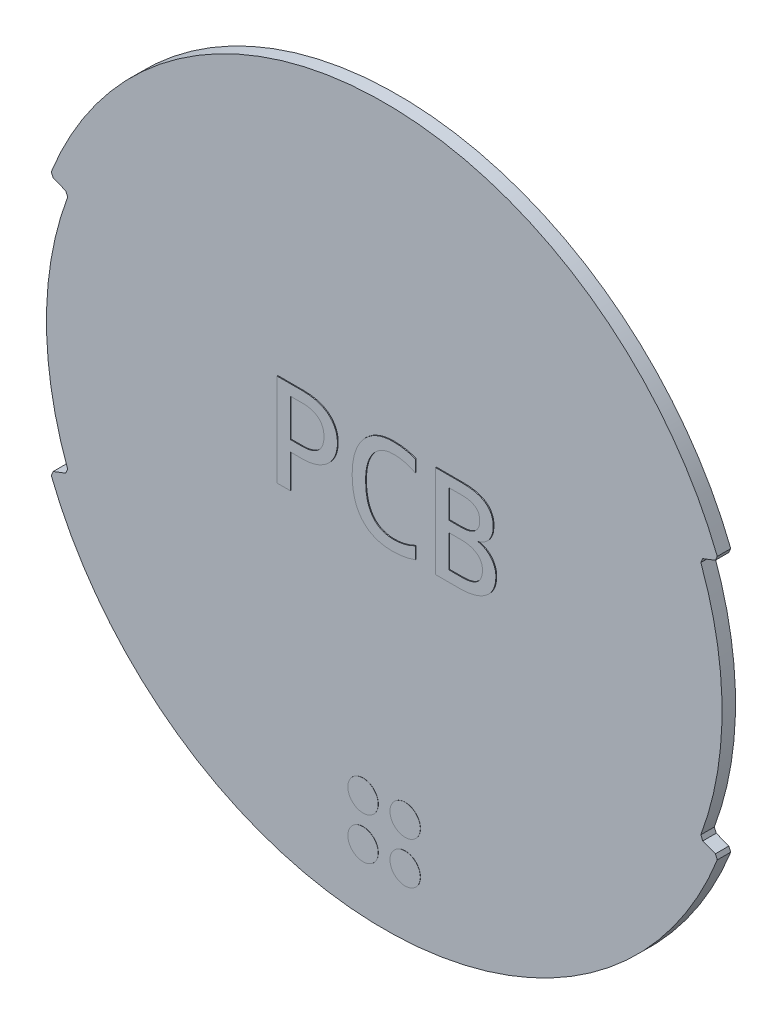
from build123d import *

# Parameters (mm, degrees)
EXTRUDE_1_DEPTH        = 0.8
EXTRUDE_2_DEPTH        = 0.05
EXTRUDE_2_DEPTH_BACK   = 0.85
EXTRUDE_2_2_DEPTH      = 0.05
EXTRUDE_2_2_DEPTH_BACK = 0.85
EXTRUDE_2_3_DEPTH      = 0.05
EXTRUDE_2_3_DEPTH_BACK = 0.85
EXTRUDE_3_DEPTH        = 0.01
EXTRUDE_3_DEPTH_BACK   = 0.81
SKETCH_3_R             = 0.9
EXTRUDE_3_2_DEPTH      = 0.01
EXTRUDE_3_2_DEPTH_BACK = 0.81
EXTRUDE_3_3_DEPTH      = 0.01
EXTRUDE_3_3_DEPTH_BACK = 0.81
EXTRUDE_3_4_DEPTH      = 0.01
EXTRUDE_3_4_DEPTH_BACK = 0.81
CUT_EXTRUDE_3_DEPTH    = 31.064056615
CHAMFER_2_SIZE         = 0.2


with BuildPart() as part:
    # 草图1 → 凸台-拉伸1 (new body)
    with BuildSketch(Plane.XY):
        with BuildLine():
            ThreePointArc((7.33208531, -19.945), (0, 21.25), (-7.33208531, -19.945))
            ThreePointArc((-7.33208531, -19.945), (0, -21.25), (7.33208531, -19.945))
        make_face()
    extrude(amount=EXTRUDE_1_DEPTH)

    # 草图5 → 切除-拉伸3 (cut, through all)
    with BuildSketch(Plane.XY.offset(0.8)):
        with BuildLine():
            Line((19.838584063, 7.615318928), (18.718287551, 7.185277388))
            ThreePointArc((18.718287551, 7.185277388), (20.05, 0), (18.718287551, -7.185277388))
            Line((18.718287551, -7.185277388), (19.838584063, -7.615318928))
            ThreePointArc((19.838584063, -7.615318928), (21.25, 0), (19.838584063, 7.615318928))
        make_face()
        with BuildLine():
            Line((-19.838584063, -7.615318928), (-18.718287551, -7.185277388))
            ThreePointArc((-18.718287551, -7.185277388), (-20.05, 0), (-18.718287551, 7.185277388))
            Line((-18.718287551, 7.185277388), (-19.838584063, 7.615318928))
            ThreePointArc((-19.838584063, 7.615318928), (-21.25, 0), (-19.838584063, -7.615318928))
        make_face()
    extrude(amount=-CUT_EXTRUDE_3_DEPTH, mode=Mode.SUBTRACT)

    # 倒角2
    chamfer_2_edges = [part.edges().sort_by_distance(p)[0] for p in [
        (19.838584063, 7.615318928, 0.4),
        (19.838584063, -7.615318928, 0.4),
        (18.718287551, -7.185277388, 0.4),
        (18.718287551, 7.185277388, 0.4),
        (-18.718287551, 7.185277388, 0.4),
        (-18.718287551, -7.185277388, 0.4),
        (-19.838584063, -7.615318928, 0.4),
        (-19.838584063, 7.615318928, 0.4),
    ]]
    chamfer(chamfer_2_edges, length=CHAMFER_2_SIZE)


with BuildPart() as body_2:
    # 草图4 → 凸台-拉伸2 (new, two sides: drawn at the far end of the back side and taken through both)
    with BuildSketch(Plane.XY.offset(0.8).offset(-EXTRUDE_2_DEPTH_BACK)):
        with BuildLine():
            add(Edge.make_bspline(
                [(-2.731516505, 2.381691019), (-2.732862475, 2.32597472), (-2.735566518, 2.214041156), (-2.760530165, 2.046937134), (-2.799186238, 1.880728566), (-2.852287983, 1.716508393), (-2.921928945, 1.556702666), (-3.00895342, 1.404159902), (-3.115334826, 1.261745648), (-3.235675084, 1.126427941), (-3.374816018, 1.002751945), (-3.532091973, 0.891318799), (-3.707057493, 0.792111819), (-3.899187593, 0.703830584), (-4.111000859, 0.634552813), (-4.341909665, 0.583143641), (-4.592734544, 0.553748414), (-4.766539194, 0.550193437), (-4.856290055, 0.548357685)],
                knots=[0, 0, 0, 0, 0.84837333, 1.704374698, 2.568122001, 3.446177459, 4.329841521, 5.219461111, 6.115085959, 7.03322926, 7.973947317, 8.94447037, 9.964314875, 11.034235969, 12.160282575, 13.352588404, 14.632904974, 16, 16, 16, 16], degree=3))
            Line((-4.856290055, 0.548357685), (-5.521371577, 0.548357685))
            Line((-5.521371577, 0.548357685), (-5.521371577, -1.444395938))
            Line((-5.521371577, -1.444395938), (-6.318473026, -1.444395938))
            Line((-6.318473026, -1.444395938), (-6.318473026, 4.055604062))
            Line((-6.318473026, 4.055604062), (-4.780316324, 4.055604062))
            add(Edge.make_bspline(
                [(-4.780316324, 4.055604062), (-4.713430546, 4.054895688), (-4.580668465, 4.053489631), (-4.384098577, 4.034666853), (-4.191330257, 4.008150782), (-4.003932812, 3.968510267), (-3.823991075, 3.91650399), (-3.653039125, 3.853024136), (-3.495798807, 3.770226831), (-3.348145611, 3.677447485), (-3.212161303, 3.570345255), (-3.092530855, 3.446054531), (-2.987022399, 3.307593009), (-2.895642916, 3.155286199), (-2.820406223, 2.986553747), (-2.769841435, 2.799600775), (-2.735896035, 2.596313682), (-2.733010576, 2.454909282), (-2.731516505, 2.381691019)],
                knots=[0, 0, 0, 0, 1.071095419, 2.126025337, 3.160633674, 4.187194637, 5.191188192, 6.159546808, 7.102471747, 8.032359578, 8.950543616, 9.867691343, 10.788184798, 11.733733012, 12.707489344, 13.737062018, 14.82826569, 16, 16, 16, 16], degree=3))
        make_face()
        with BuildLine():
            add(Edge.make_bspline(
                [(-3.528617954, 2.339345004), (-3.529413085, 2.381747791), (-3.530962825, 2.464392403), (-3.547621714, 2.584077962), (-3.573854757, 2.69626785), (-3.609587953, 2.80086484), (-3.655911113, 2.898180286), (-3.713832651, 2.986882975), (-3.781517456, 3.068824269), (-3.860112264, 3.142071599), (-3.948072836, 3.20654767), (-4.042758833, 3.264830073), (-4.147222984, 3.311927272), (-4.260027995, 3.350106718), (-4.380550897, 3.381844982), (-4.509960244, 3.401818439), (-4.646707204, 3.416648509), (-4.740831942, 3.417491298), (-4.789034621, 3.417922903)],
                knots=[0, 0, 0, 0, 1.07893025, 2.102875295, 3.069403633, 4.00867391, 4.911619206, 5.805799344, 6.69897942, 7.61127936, 8.532960211, 9.47193309, 10.436783978, 11.442898866, 12.50165651, 13.605056338, 14.773513735, 16, 16, 16, 16], degree=3))
            Line((-4.789034621, 3.417922903), (-5.521371577, 3.417922903))
            Line((-5.521371577, 3.417922903), (-5.521371577, 1.186038845))
            Line((-5.521371577, 1.186038845), (-4.852553642, 1.186038845))
            add(Edge.make_bspline(
                [(-4.852553642, 1.186038845), (-4.801051265, 1.187155918), (-4.701215689, 1.189321327), (-4.555486892, 1.201457721), (-4.41872189, 1.223287159), (-4.291540689, 1.256124256), (-4.173395785, 1.295769631), (-4.064076242, 1.344197714), (-3.964145681, 1.40317903), (-3.872819543, 1.47040723), (-3.790727591, 1.546527092), (-3.721002909, 1.633586066), (-3.660663278, 1.728550028), (-3.611616863, 1.833139092), (-3.57490617, 1.947159073), (-3.547349334, 2.069646479), (-3.530963796, 2.201483296), (-3.529417025, 2.292384778), (-3.528617954, 2.339345004)],
                knots=[0, 0, 0, 0, 1.232805628, 2.389751021, 3.4973379, 4.54330244, 5.530003372, 6.477393866, 7.399377973, 8.301660217, 9.187431021, 10.070466494, 10.963674817, 11.874940633, 12.827061481, 13.825105319, 14.876436953, 16, 16, 16, 16], degree=3))
        make_face(mode=Mode.SUBTRACT)
    extrude(amount=EXTRUDE_2_DEPTH + EXTRUDE_2_DEPTH_BACK)


with BuildPart() as body_3:
    # 草图4 → Extrude 2 2 (new, two sides: drawn at the far end of the back side and taken through both)
    with BuildSketch(Plane.XY.offset(0.8).offset(-EXTRUDE_2_2_DEPTH_BACK)):
        with BuildLine():
            add(Edge.make_bspline(
                [(1.891671901, -1.284975648), (1.782253148, -1.32193814), (1.563969937, -1.39567588), (1.224606289, -1.469131943), (0.878337028, -1.515650824), (0.644275504, -1.521277901), (0.526635669, -1.524106083)],
                knots=[0, 0, 0, 0, 0.994474773, 1.983911717, 2.986709619, 4, 4, 4, 4], degree=3))
            add(Edge.make_bspline(
                [(0.526635669, -1.524106083), (0.433549362, -1.521942806), (0.252187121, -1.517728044), (-0.011473176, -1.485371553), (-0.258350013, -1.430495596), (-0.489169625, -1.354778912), (-0.703539663, -1.256354343), (-0.900370622, -1.134292053), (-1.080910415, -0.991786582), (-1.244074008, -0.827117074), (-1.389190895, -0.640900774), (-1.513410484, -0.432368839), (-1.62055587, -0.204087339), (-1.704683831, 0.046306986), (-1.774483685, 0.316126311), (-1.819838114, 0.607315564), (-1.849306226, 0.918898652), (-1.852866206, 1.13365553), (-1.85470491, 1.244575982)],
                knots=[0, 0, 0, 0, 1.072370344, 2.089324368, 3.054894172, 3.982167072, 4.883220536, 5.766007853, 6.644560033, 7.52738623, 8.430658994, 9.357672753, 10.318538922, 11.330575956, 12.396783324, 13.526066154, 14.722230158, 16, 16, 16, 16], degree=3))
            add(Edge.make_bspline(
                [(-1.85470491, 1.244575982), (-1.85238457, 1.352580653), (-1.847841097, 1.564065303), (-1.817279765, 1.873245128), (-1.762908431, 2.166112613), (-1.690922942, 2.4429622), (-1.59555392, 2.700847293), (-1.483913522, 2.940400648), (-1.352844228, 3.159103514), (-1.204193072, 3.357374394), (-1.037163081, 3.534116208), (-0.853908629, 3.690654483), (-0.65284616, 3.824440769), (-0.436862006, 3.937080856), (-0.20504086, 4.026095613), (0.040770902, 4.088592129), (0.299872401, 4.129035838), (0.477075984, 4.133189253), (0.567736213, 4.135314207)],
                knots=[0, 0, 0, 0, 1.219579151, 2.388065895, 3.50339749, 4.580233523, 5.613961845, 6.603771101, 7.560489467, 8.487754287, 9.396405489, 10.300984393, 11.203313264, 12.1174982, 13.046432371, 14.000390303, 14.976967236, 16, 16, 16, 16], degree=3))
            add(Edge.make_bspline(
                [(0.567736213, 4.135314207), (0.629616876, 4.134661601), (0.75140622, 4.133377187), (0.930409184, 4.121337827), (1.102709857, 4.105116448), (1.321685196, 4.06927615), (1.587647357, 4.009317843), (1.790672818, 3.933767703), (1.891671901, 3.896183772)],
                knots=[0, 0, 0, 0, 0.82263702, 1.61905864, 2.384719601, 3.122514214, 4.568537041, 6, 6, 6, 6], degree=3))
            Line((1.891671901, 3.896183772), (1.891671901, 3.178792468))
            add(Edge.make_bspline(
                [(1.891671901, 3.178792468), (1.842560318, 3.203900764), (1.745237611, 3.253656996), (1.594103363, 3.317435558), (1.44067524, 3.372014914), (1.283407881, 3.417157964), (1.122176373, 3.453631498), (0.954155566, 3.48006475), (0.778904345, 3.494768525), (0.659512452, 3.496668198), (0.598872988, 3.497633048)],
                knots=[0, 0, 0, 0, 0.983614603, 1.949194672, 2.923566415, 3.886871985, 4.866016098, 5.870457402, 6.918399582, 8, 8, 8, 8], degree=3))
            add(Edge.make_bspline(
                [(0.598872988, 3.497633048), (0.536879338, 3.496299787), (0.415510676, 3.493689583), (0.238266753, 3.463074147), (0.069429941, 3.418164042), (-0.089538688, 3.352438257), (-0.238630604, 3.270679319), (-0.375114635, 3.169248399), (-0.501610232, 3.053500623), (-0.615421677, 2.920313261), (-0.716374679, 2.771330322), (-0.8048582, 2.60663439), (-0.88263592, 2.426968227), (-0.944864761, 2.230950253), (-0.996738066, 2.021056655), (-1.032017813, 1.796477177), (-1.05331836, 1.557604407), (-1.05614802, 1.393663704), (-1.057603461, 1.309340475)],
                knots=[0, 0, 0, 0, 0.961408976, 1.882207611, 2.784411545, 3.668921893, 4.545980223, 5.417431557, 6.302341026, 7.202770486, 8.13058038, 9.09095177, 10.101446619, 11.165409356, 12.279999165, 13.455113719, 14.691032636, 16, 16, 16, 16], degree=3))
            add(Edge.make_bspline(
                [(-1.057603461, 1.309340475), (-1.056576239, 1.221288932), (-1.054586769, 1.050755443), (-1.034520921, 0.803218592), (-1.000961542, 0.572391793), (-0.955800016, 0.357674158), (-0.896036867, 0.159621384), (-0.822721217, -0.021375749), (-0.736674921, -0.186279439), (-0.636796181, -0.333746514), (-0.524295051, -0.465122013), (-0.39713558, -0.577023791), (-0.259672612, -0.67508953), (-0.107275478, -0.751204751), (0.055449963, -0.813723386), (0.231517222, -0.854664422), (0.419086936, -0.881930194), (0.548535058, -0.884899082), (0.615064111, -0.886424923)],
                knots=[0, 0, 0, 0, 1.34450783, 2.603970389, 3.789343747, 4.904814261, 5.951782154, 6.944310538, 7.883053746, 8.786934864, 9.658944679, 10.516661903, 11.367981323, 12.229999549, 13.110838734, 14.024275634, 14.984588823, 16, 16, 16, 16], degree=3))
            add(Edge.make_bspline(
                [(0.615064111, -0.886424923), (0.672398284, -0.885600577), (0.78605603, -0.883966414), (0.954475661, -0.866859865), (1.119245848, -0.841032003), (1.333779877, -0.792440763), (1.595446677, -0.70913187), (1.793000837, -0.61473308), (1.891671901, -0.567584344)],
                knots=[0, 0, 0, 0, 0.776705674, 1.539720753, 2.291683871, 3.035542813, 4.519362263, 6, 6, 6, 6], degree=3))
            Line((1.891671901, -0.567584344), (1.891671901, -1.284975648))
        make_face()
    extrude(amount=EXTRUDE_2_2_DEPTH + EXTRUDE_2_2_DEPTH_BACK)


with BuildPart() as body_4:
    # 草图4 → Extrude 2 3 (new, two sides: drawn at the far end of the back side and taken through both)
    with BuildSketch(Plane.XY.offset(0.8).offset(-EXTRUDE_2_3_DEPTH_BACK)):
        with BuildLine():
            add(Edge.make_bspline(
                [(6.674280597, 0.220798808), (6.672373801, 0.155923443), (6.668650742, 0.02925297), (6.639474014, -0.154605684), (6.592275742, -0.327508399), (6.524858064, -0.488490739), (6.43900963, -0.637241795), (6.339404762, -0.775914475), (6.221159456, -0.900803908), (6.087119767, -1.01313202), (5.937969703, -1.113146088), (5.774128274, -1.200068746), (5.595825184, -1.275295108), (5.403195127, -1.336960746), (5.197793967, -1.384981693), (4.98105263, -1.420268603), (4.752872553, -1.439614306), (4.596869147, -1.442778497), (4.5171248, -1.444395938)],
                knots=[0, 0, 0, 0, 1.013216857, 1.978326566, 2.900521816, 3.80762901, 4.696652207, 5.578905641, 6.469134838, 7.376056482, 8.306156408, 9.269586241, 10.269510869, 11.325927403, 12.425683058, 13.562442612, 14.753992443, 16, 16, 16, 16], degree=3))
            Line((4.5171248, -1.444395938), (3.087324075, -1.444395938))
            Line((3.087324075, -1.444395938), (3.087324075, 4.055604062))
            Line((3.087324075, 4.055604062), (4.667826792, 4.055604062))
            add(Edge.make_bspline(
                [(4.667826792, 4.055604062), (4.742593539, 4.054874243), (4.887333915, 4.05346139), (5.096758434, 4.036223656), (5.292018271, 4.012419196), (5.472914349, 3.976865631), (5.639036053, 3.928803014), (5.791985154, 3.873955894), (5.929662552, 3.806416588), (6.052778968, 3.728682069), (6.16256234, 3.641588781), (6.256334717, 3.541962936), (6.337003768, 3.433231206), (6.402178222, 3.313158279), (6.453420532, 3.183138953), (6.489309854, 3.042564768), (6.510544946, 2.892152919), (6.513395398, 2.788615102), (6.514860307, 2.735404787)],
                knots=[0, 0, 0, 0, 1.388776146, 2.688521212, 3.90167895, 5.042289038, 6.109239049, 7.11226345, 8.057476407, 8.951978552, 9.813306123, 10.653548746, 11.486644475, 12.322022467, 13.184316581, 14.076721024, 15.011585489, 16, 16, 16, 16], degree=3))
            add(Edge.make_bspline(
                [(6.514860307, 2.735404787), (6.512275434, 2.664637687), (6.507244487, 2.526903465), (6.466755136, 2.327683935), (6.399166438, 2.144117004), (6.320830662, 2.003977725), (6.244290415, 1.901877105), (6.177814642, 1.830602086), (6.102761369, 1.764820528), (6.020067584, 1.703274023), (5.928681299, 1.647260281), (5.828666963, 1.596275681), (5.720406376, 1.550200595), (5.644455586, 1.524322885), (5.605666466, 1.51110678)],
                knots=[0, 0, 0, 0, 1.542514348, 3.00220039, 4.41170875, 5.794260582, 6.486040375, 7.190794555, 7.915677968, 8.659981338, 9.436469499, 10.250434215, 11.106472525, 12, 12, 12, 12], degree=3))
            add(Edge.make_bspline(
                [(5.605666466, 1.51110678), (5.67652514, 1.494193397), (5.818037773, 1.460415497), (5.984642607, 1.385466682), (6.110503742, 1.313894426), (6.198271969, 1.250467689), (6.280750135, 1.180952398), (6.356915404, 1.103286866), (6.426839177, 1.018531792), (6.48962057, 0.926277507), (6.542608759, 0.825399536), (6.590882237, 0.718758635), (6.627679826, 0.603762845), (6.655464982, 0.482201008), (6.671794484, 0.353680961), (6.673440867, 0.265682159), (6.674280597, 0.220798808)],
                knots=[0, 0, 0, 0, 1.670885493, 3.336943679, 4.174711656, 4.995358125, 5.821090152, 6.65083528, 7.491206374, 8.34319308, 9.209637874, 10.10658404, 11.029731221, 11.978595832, 12.968992875, 14, 14, 14, 14], degree=3))
        make_face()
        with BuildLine():
            add(Edge.make_bspline(
                [(5.717758858, 2.632030693), (5.715471305, 2.685394482), (5.710979883, 2.790169867), (5.678675291, 2.916899365), (5.640842948, 3.011761425), (5.602550151, 3.077492759), (5.553627854, 3.137303087), (5.496144466, 3.191831139), (5.429551382, 3.242696447), (5.351113904, 3.285888063), (5.262224348, 3.324389721), (5.162300281, 3.35794011), (5.05035612, 3.385510757), (4.925004725, 3.405291079), (4.785917675, 3.415883195), (4.688601936, 3.417224543), (4.637935488, 3.417922903)],
                knots=[0, 0, 0, 0, 1.467350645, 2.88102155, 3.572915596, 4.274650825, 4.965411238, 5.692918483, 6.45179769, 7.26549663, 8.150919223, 9.115896111, 10.16367939, 11.321101063, 12.605258578, 14, 14, 14, 14], degree=3))
            Line((4.637935488, 3.417922903), (3.884425524, 3.417922903))
            Line((3.884425524, 3.417922903), (3.884425524, 1.744009859))
            Line((3.884425524, 1.744009859), (4.613026068, 1.744009859))
            add(Edge.make_bspline(
                [(4.613026068, 1.744009859), (4.692496648, 1.74656558), (4.844565124, 1.751456002), (5.028566334, 1.784521698), (5.16271922, 1.823413572), (5.252419197, 1.863738254), (5.337280301, 1.906071063), (5.412886174, 1.959241245), (5.482361806, 2.017837335), (5.543328366, 2.083995289), (5.596437743, 2.156910809), (5.640083092, 2.237383639), (5.675315166, 2.325015272), (5.699915687, 2.420446065), (5.715201647, 2.523596012), (5.716886156, 2.595025083), (5.717758858, 2.632030693)],
                knots=[0, 0, 0, 0, 2.073538655, 3.967755928, 4.862618563, 5.712230629, 6.531505899, 7.334196252, 8.118305519, 8.900614993, 9.67674368, 10.467342855, 11.284464589, 12.136217, 13.034420764, 14, 14, 14, 14], degree=3))
        make_face(mode=Mode.SUBTRACT)
        with BuildLine():
            add(Edge.make_bspline(
                [(5.877179148, 0.192152975), (5.876352556, 0.226676824), (5.874729553, 0.294464052), (5.858061666, 0.393598384), (5.830741225, 0.487217534), (5.792802281, 0.575273011), (5.745942945, 0.657800444), (5.68760372, 0.732724606), (5.621102983, 0.80246576), (5.543720868, 0.864293554), (5.457179182, 0.91879094), (5.362822183, 0.968032623), (5.259447368, 1.010171831), (5.147260558, 1.044688609), (5.02695517, 1.072209913), (4.899140088, 1.091504963), (4.763588742, 1.104734666), (4.670766655, 1.105787032), (4.622989836, 1.1063287)],
                knots=[0, 0, 0, 0, 0.948445084, 1.862262358, 2.754366203, 3.623615494, 4.492864785, 5.355796555, 6.227589923, 7.136690505, 8.070741307, 9.035595869, 10.059344591, 11.135152229, 12.259281394, 13.44900263, 14.686966176, 16, 16, 16, 16], degree=3))
            Line((4.622989836, 1.1063287), (3.884425524, 1.1063287))
            Line((3.884425524, 1.1063287), (3.884425524, -0.806714778))
            Line((3.884425524, -0.806714778), (4.647899256, -0.806714778))
            add(Edge.make_bspline(
                [(4.647899256, -0.806714778), (4.698159041, -0.806073756), (4.7950759, -0.80483766), (4.935617494, -0.793232871), (5.066514126, -0.775498744), (5.187066182, -0.747788981), (5.297972016, -0.714186628), (5.399567073, -0.673768122), (5.490362445, -0.623309998), (5.572922311, -0.567501851), (5.644462503, -0.501597323), (5.70743662, -0.427956372), (5.759807655, -0.344542912), (5.803503596, -0.253536248), (5.837297159, -0.154027398), (5.860711823, -0.046242401), (5.874219429, 0.070168017), (5.876170978, 0.150601207), (5.877179148, 0.192152975)],
                knots=[0, 0, 0, 0, 1.326701194, 2.558302104, 3.720902774, 4.811133236, 5.820090824, 6.778795896, 7.691204955, 8.557756331, 9.403467856, 10.251165954, 11.10865784, 11.996033528, 12.91113804, 13.8765245, 14.903013039, 16, 16, 16, 16], degree=3))
        make_face(mode=Mode.SUBTRACT)
    extrude(amount=EXTRUDE_2_3_DEPTH + EXTRUDE_2_3_DEPTH_BACK)


with BuildPart() as body_5:
    # 草图3 → 凸台-拉伸3 (new, two sides: drawn at the far end of the back side and taken through both)
    with BuildSketch(Plane(origin=(0, 0, 0), x_dir=(-1, 0, 0), z_dir=(0, 0, -1)).offset(-EXTRUDE_3_DEPTH_BACK)):
        with Locations((-1.25, -14.995)):
            Circle(SKETCH_3_R)
    extrude(amount=EXTRUDE_3_DEPTH + EXTRUDE_3_DEPTH_BACK)


with BuildPart() as body_6:
    # 草图3 → Extrude 3 2 (new, two sides: drawn at the far end of the back side and taken through both)
    with BuildSketch(Plane(origin=(0, 0, 0), x_dir=(-1, 0, 0), z_dir=(0, 0, -1)).offset(-EXTRUDE_3_2_DEPTH_BACK)):
        with Locations(Location((1.25, -14.995, 0), (0, 0, 180))):
            Circle(SKETCH_3_R)
    extrude(amount=EXTRUDE_3_2_DEPTH + EXTRUDE_3_2_DEPTH_BACK)


with BuildPart() as body_7:
    # 草图3 → Extrude 3 3 (new, two sides: drawn at the far end of the back side and taken through both)
    with BuildSketch(Plane(origin=(0, 0, 0), x_dir=(-1, 0, 0), z_dir=(0, 0, -1)).offset(-EXTRUDE_3_3_DEPTH_BACK)):
        with Locations((1.25, -17.495)):
            Circle(SKETCH_3_R)
    extrude(amount=EXTRUDE_3_3_DEPTH + EXTRUDE_3_3_DEPTH_BACK)


with BuildPart() as body_8:
    # 草图3 → Extrude 3 4 (new, two sides: drawn at the far end of the back side and taken through both)
    with BuildSketch(Plane(origin=(0, 0, 0), x_dir=(-1, 0, 0), z_dir=(0, 0, -1)).offset(-EXTRUDE_3_4_DEPTH_BACK)):
        with Locations(Location((-1.25, -17.495, 0), (0, 0, 180))):
            Circle(SKETCH_3_R)
    extrude(amount=EXTRUDE_3_4_DEPTH + EXTRUDE_3_4_DEPTH_BACK)


solid = Compound([part.part, body_2.part, body_3.part, body_4.part, body_5.part, body_6.part, body_7.part, body_8.part])
